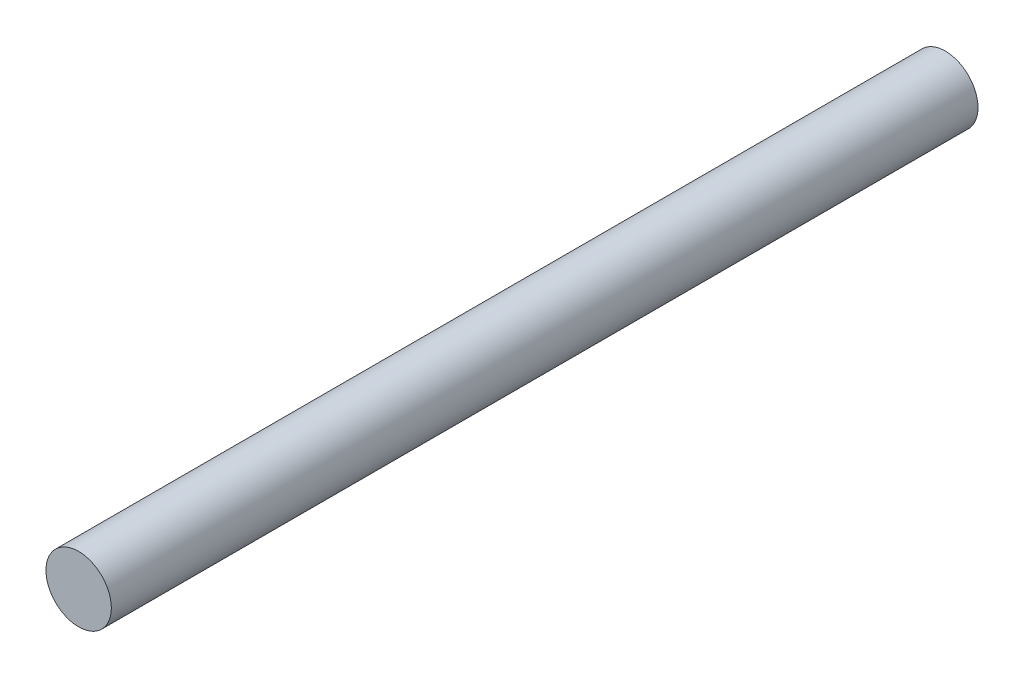
from build123d import *

# Parameters (mm, degrees)
SKETCH1_R           = 4
BOSS_EXTRUDE1_DEPTH = 106


with BuildPart() as part:
    # Sketch1 → Boss-Extrude1 (new body)
    with BuildSketch(Plane.XY):
        Circle(SKETCH1_R)
    extrude(amount=BOSS_EXTRUDE1_DEPTH)


solid = part.part
